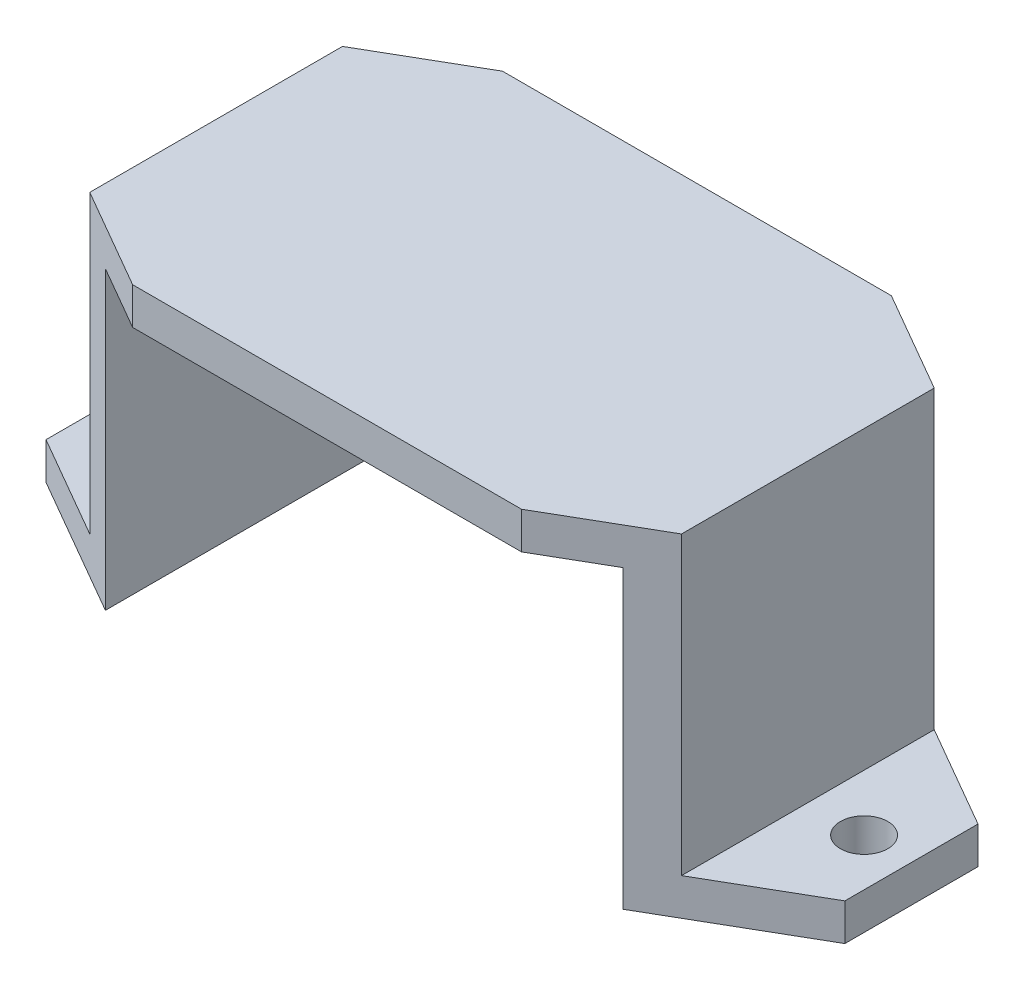
from build123d import *

# Parameters (mm, degrees)
EXTRUDE_THIN1_DEPTH = 25
CUT_EXTRUDE1_DEPTH  = 64.618000597
SKETCH3_R           = 1.6
CUT_EXTRUDE2_DEPTH  = 63.777384463


with BuildPart() as part:
    # Sketch1 → Extrude-Thin1 (new body)
    with BuildSketch(Plane.XY):
        Polygon((0, 0), (7, 0), (7, 20), (47, 20), (47, 0), (54, 0), (54, -2.5), (44.5, -2.5), (44.5, 17.5), (9.5, 17.5), (9.5, -2.5), (0, -2.5), align=None)
    extrude(amount=EXTRUDE_THIN1_DEPTH)

    # Sketch2 → Cut-Extrude1 (cut, through all)
    with BuildSketch(Plane(origin=(0, 20, 0), x_dir=(1, 0, 0), z_dir=(0, 1, 0))):
        Polygon((0, -8), (13.856406461, 0), (7, 0), (0, 0), align=None)
        Polygon((0, -17), (13.856406461, -25), (7, -25), (0, -25), align=None)
        Polygon((54, -17), (40.143593539, -25), (47, -25), (54, -25), align=None)
        Polygon((54, -8), (40.143593539, 0), (47, 0), (54, 0), align=None)
    extrude(amount=-CUT_EXTRUDE1_DEPTH, mode=Mode.SUBTRACT)

    # Sketch3 → Cut-Extrude2 (cut, through all)
    with BuildSketch(Plane(origin=(0, 0, 0), x_dir=(1, 0, 0), z_dir=(0, 1, 0))):
        with Locations(Location((50.8, -12.5, 0), (0, 0, 270))):
            Circle(SKETCH3_R)
        with Locations(Location((3.2, -12.5, 0), (0, 0, 270))):
            Circle(SKETCH3_R)
    extrude(amount=-CUT_EXTRUDE2_DEPTH, mode=Mode.SUBTRACT)


solid = part.part
